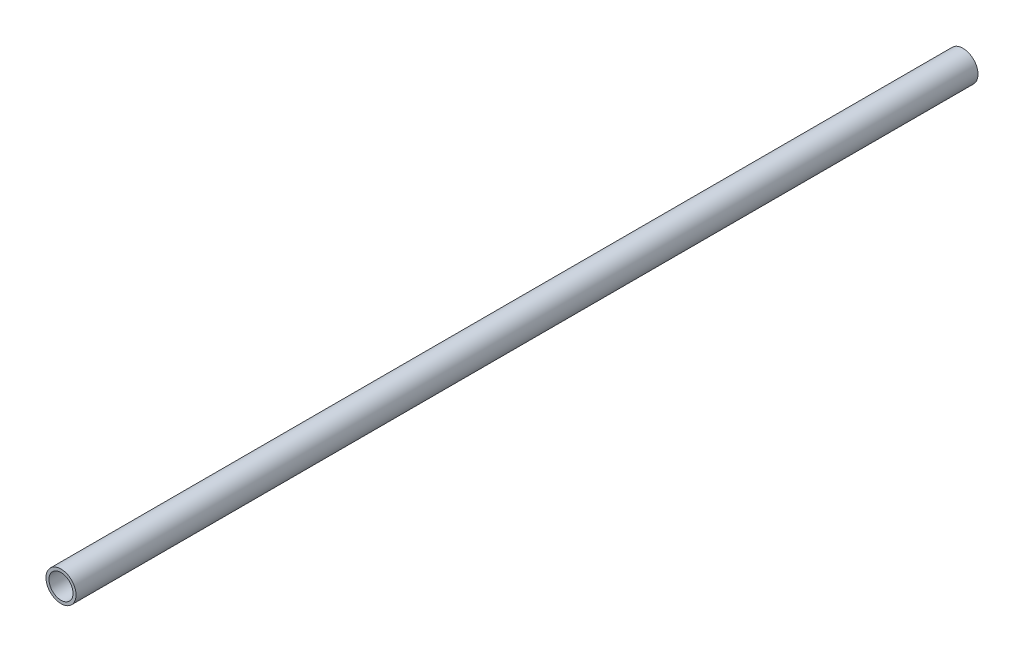
from build123d import *

# Parameters (mm, degrees)
SKETCH1_R           = 5
SKETCH1_R_2         = 4
BOSS_EXTRUDE1_DEPTH = 300


with BuildPart() as part:
    # Sketch1 → Boss-Extrude1 (new body)
    with BuildSketch(Plane.XY):
        Circle(SKETCH1_R)
        Circle(SKETCH1_R_2, mode=Mode.SUBTRACT)
    extrude(amount=BOSS_EXTRUDE1_DEPTH)


solid = part.part
